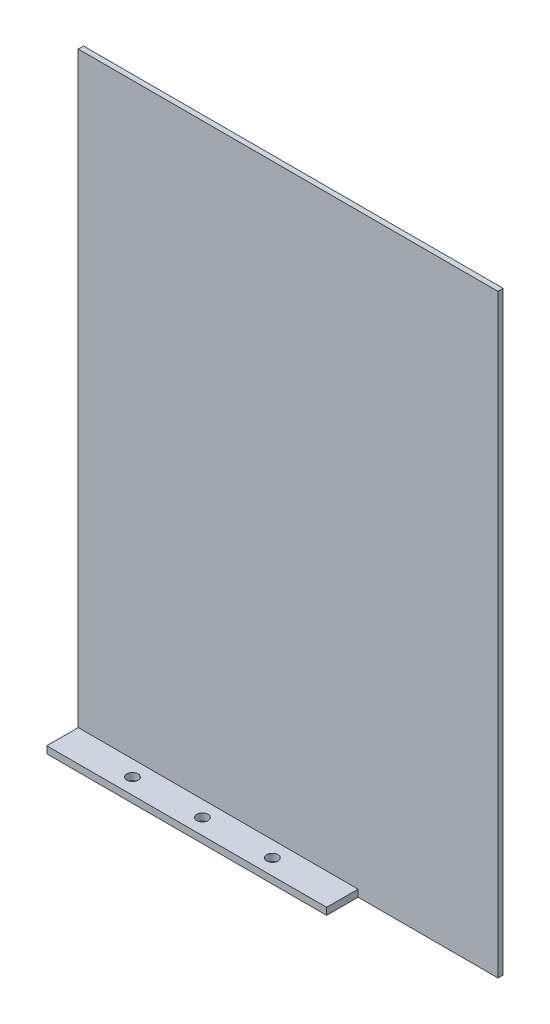
from build123d import *

# Parameters (mm, degrees)
SKETCH_1_W          = 120
SKETCH_1_H          = 170
EXTRUDE_1_DEPTH     = 1.5
SKETCH_2_W          = 80
SKETCH_2_H          = 2
EXTRUDE_2_DEPTH     = 9
SKETCH_3_R          = 1.6
CUT_EXTRUDE_1_DEPTH = 9


with BuildPart() as part:
    # 草图1 → 凸台-拉伸1 (new body)
    with BuildSketch(Plane.XY):
        with Locations((60, -85)):
            Rectangle(SKETCH_1_W, SKETCH_1_H)
    extrude(amount=EXTRUDE_1_DEPTH)

    # 草图2 → 凸台-拉伸2 (add)
    with BuildSketch(Plane.XY.offset(1.5)):
        with Locations((40, -169)):
            Rectangle(SKETCH_2_W, SKETCH_2_H)
    extrude(amount=EXTRUDE_2_DEPTH)

    # 草图3 → 切除-拉伸1 (cut)
    with BuildSketch(Plane(origin=(0, -168, 0), x_dir=(1, 0, 0), z_dir=(0, 1, 0))):
        with Locations(Location((20, -6, 0), (0, 0, 270))):
            Circle(SKETCH_3_R)
        with Locations(Location((40, -6, 0), (0, 0, 270))):
            Circle(SKETCH_3_R)
        with Locations(Location((60, -6, 0), (0, 0, 270))):
            Circle(SKETCH_3_R)
    extrude(amount=-CUT_EXTRUDE_1_DEPTH, mode=Mode.SUBTRACT)


solid = part.part
